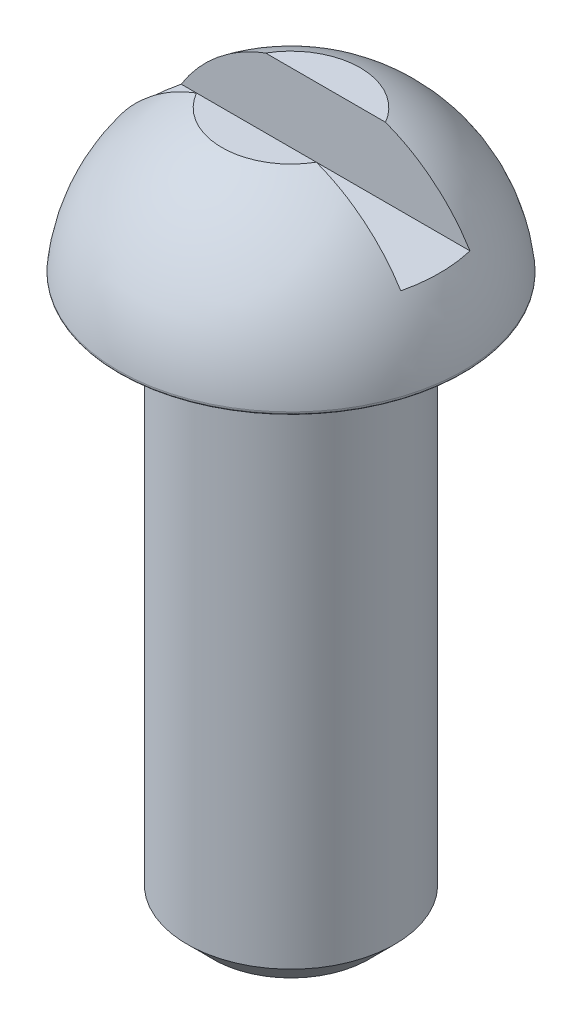
from build123d import *

# Parameters (mm, degrees)
FILLET_1_R          = 0.1
SKETCH_3_W          = 10
SKETCH_3_H          = 2
CUT_EXTRUDE_2_DEPTH = 2


with BuildPart() as part:
    # Эскиз1 → Повернуть1 (revolve)
    with BuildSketch(Plane.XY):
        with BuildLine():
            Line((5, 16), (3, 16))
            Line((3, 16), (3, 0.75))
            Line((3, 0.75), (2.25, 0))
            Line((2.25, 0), (0, 0))
            Line((0, 0), (0, 20.2))
            Line((0, 20.2), (2, 20.2))
            ThreePointArc((2, 20.2), (4.083835358, 18.517025256), (5, 16))
        make_face()
    revolve(axis=Axis((0, 0, 0), (0, 1, 0)))

    # Скругление1
    fillet_1_edges = [part.edges().sort_by_distance(p)[0] for p in [
        (-5, 16, 0),
    ]]
    fillet(fillet_1_edges, radius=FILLET_1_R)

    # Эскиз3 → Вырез-Вытянуть2 (cut)
    with BuildSketch(Plane(origin=(0, 20.2, 0), x_dir=(-1, 0, 0), z_dir=(0, 1, 0))):
        Rectangle(SKETCH_3_W, SKETCH_3_H)
    extrude(amount=-CUT_EXTRUDE_2_DEPTH, mode=Mode.SUBTRACT)


solid = part.part
